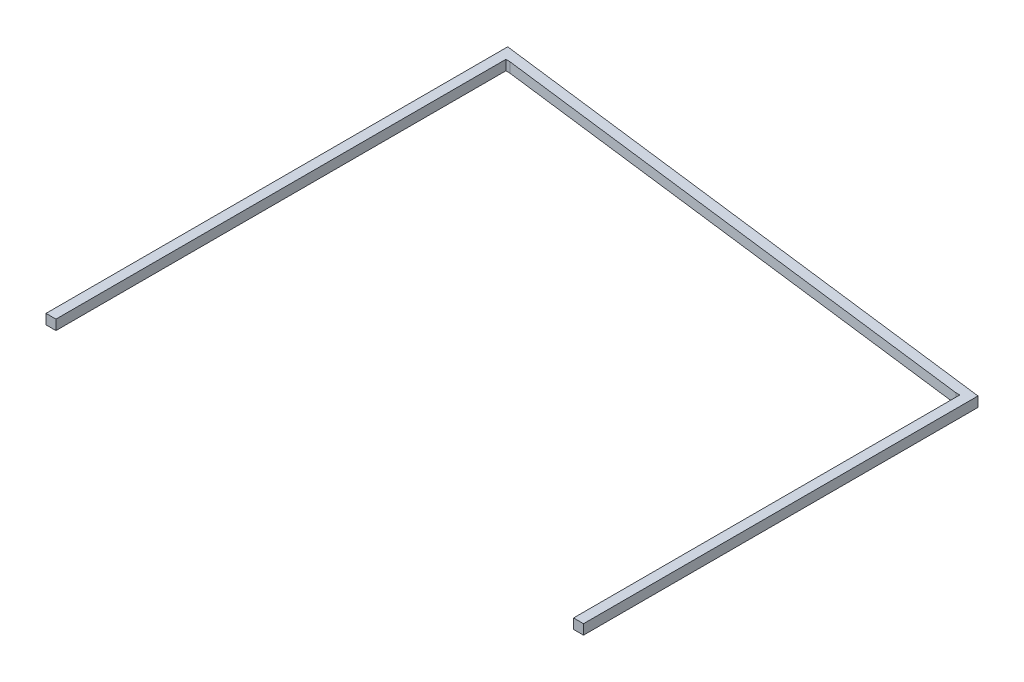
from build123d import *

# Parameters (mm, degrees)
BOSS_EXTRUDE1_DEPTH = 7.9375


with BuildPart() as part:
    # Sketch2 → Boss-Extrude1 (new body)
    with BuildSketch(Plane(origin=(0, 0, 0), x_dir=(1, 0, 0), z_dir=(0, 1, 0))):
        Polygon((420.6875, 0), (412.75, 0), (412.75, 307.975), (409.575, 307.975), (3.175, 358.775), (0, 358.775), (0, 0), (-7.9375, 0), (-7.9375, 368.16333386), (420.6875, 314.58520886), align=None)
    extrude(amount=BOSS_EXTRUDE1_DEPTH)


solid = part.part
